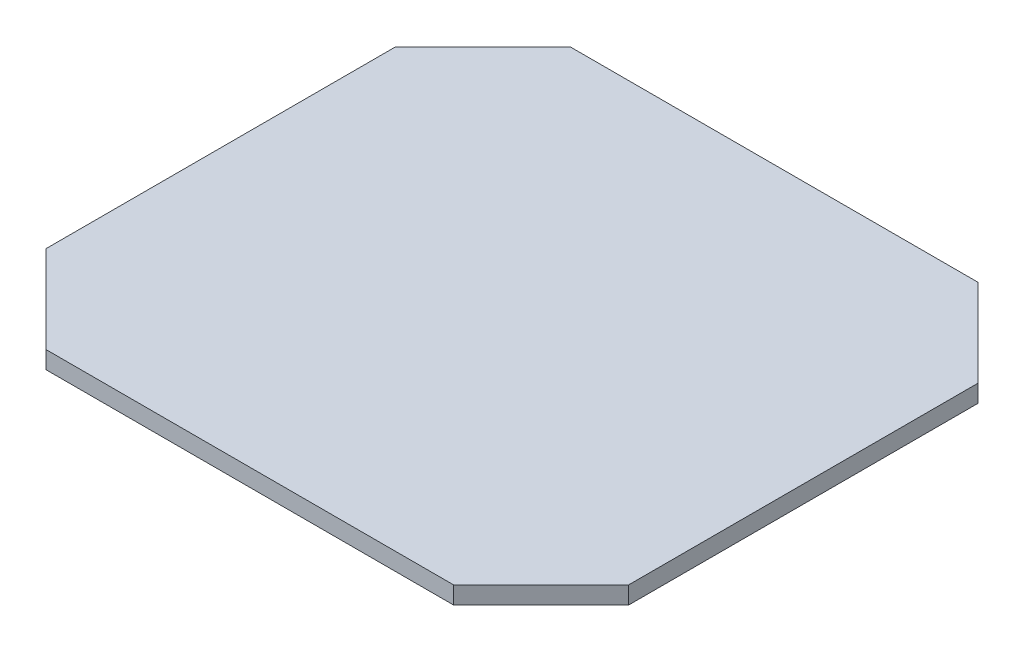
from build123d import *

# Parameters (mm, degrees)
ESBO_O1_W                = 200
ESBO_O1_H                = 180
RESSALTO_EXTRUS_O1_DEPTH = 3
CHANFRO1_SIZE            = 30


with BuildPart() as part:
    # Esboço1 → Ressalto-extrusão1 (new, symmetric)
    with BuildSketch(Plane(origin=(0, 0, 0), x_dir=(1, 0, 0), z_dir=(0, 1, 0))):
        Rectangle(ESBO_O1_W, ESBO_O1_H)
    extrude(amount=RESSALTO_EXTRUS_O1_DEPTH, both=True)

    # Chanfro1
    chanfro1_edges = [part.edges().sort_by_distance(p)[0] for p in [
        (100, 0, 90),
        (-100, 0, 90),
        (-100, 0, -90),
        (100, 0, -90),
    ]]
    chamfer(chanfro1_edges, length=CHANFRO1_SIZE)


solid = part.part
